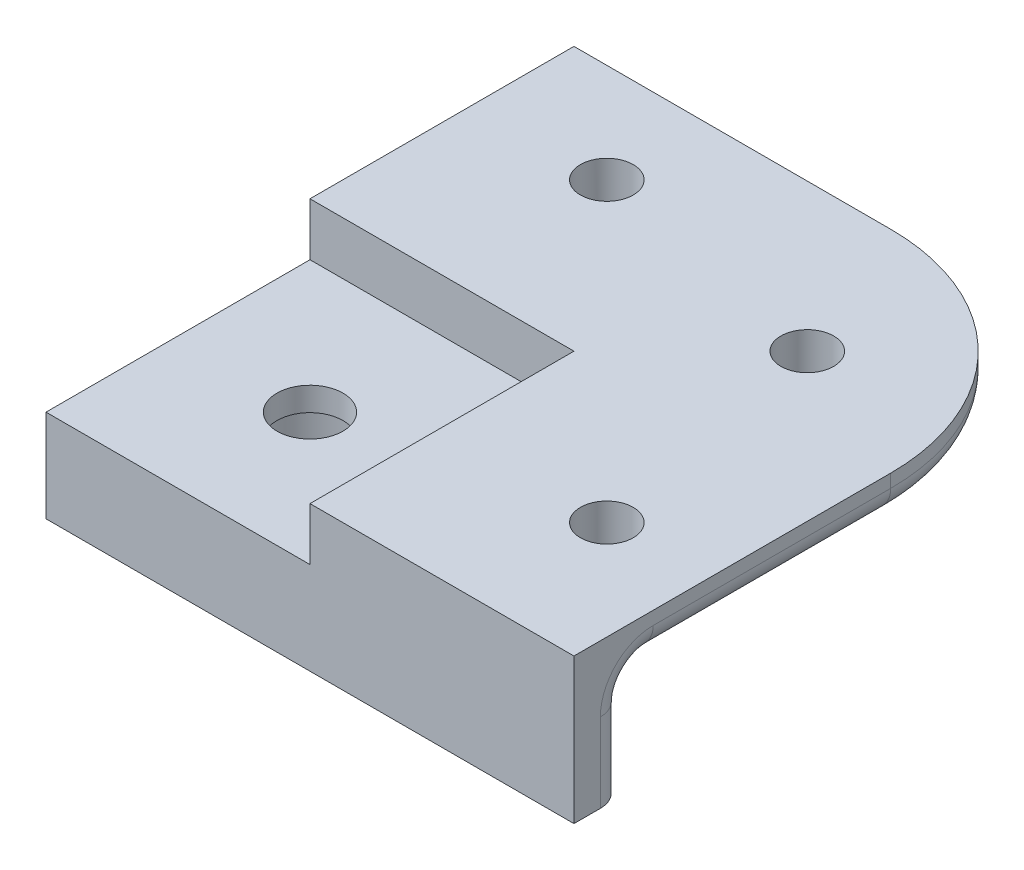
from build123d import *

# Parameters (mm, degrees)
SKETCH1_W           = 4
SKETCH1_H           = 16
BOSS_EXTRUDE1_DEPTH = 11
SKETCH2_W           = 20
SKETCH2_H           = 20
BOSS_EXTRUDE2_DEPTH = 7
SKETCH3_W           = 20
SKETCH3_H           = 16
SKETCH3_W_2         = 16
SKETCH3_H_2         = 20
BOSS_EXTRUDE3_DEPTH = 3
FILLET1_R           = 2
SKETCH4_R           = 2.5
CUT_EXTRUDE1_DEPTH  = 10
SKETCH5_R           = 4.25
CUT_EXTRUDE2_DEPTH  = 5.2
SKETCH6_R           = 2
CUT_EXTRUDE3_DEPTH  = 5.2


with BuildPart() as part:
    # Sketch1 → Boss-Extrude1 (new body)
    with BuildSketch(Plane(origin=(0, 0, 0), x_dir=(1, 0, 0), z_dir=(0, 1, 0))):
        Polygon((-10, 10), (-6, 10), (-6, 14), (-6, 30), (-10, 30), align=None)
        Polygon((-6, 10), (10, 10), (14, 10), (14, 14), (-6, 14), align=None)
        with Locations((12, 2)):
            Rectangle(SKETCH1_W, SKETCH1_H)
        Polygon((10, -6), (10, -10), (30, -10), (30, -6), (14, -6), align=None)
    extrude(amount=BOSS_EXTRUDE1_DEPTH)

    # Sketch2 → Boss-Extrude2 (add)
    with BuildSketch(Plane(origin=(0, 0, 0), x_dir=(1, 0, 0), z_dir=(0, 1, 0))):
        Rectangle(SKETCH2_W, SKETCH2_H)
    extrude(amount=BOSS_EXTRUDE2_DEPTH)

    # Sketch3 → Boss-Extrude3 (add)
    with BuildSketch(Plane(origin=(0, 11, 0), x_dir=(1, 0, 0), z_dir=(0, 1, 0))):
        with Locations((4, 22)):
            Rectangle(SKETCH3_W, SKETCH3_H)
        with BuildLine():
            Line((30, 14), (14, 14))
            Line((14, 14), (14, 30))
            ThreePointArc((14, 30), (25.313708499, 25.313708499), (30, 14))
        make_face()
        with Locations((22, 4)):
            Rectangle(SKETCH3_W_2, SKETCH3_H_2)
    extrude(amount=-BOSS_EXTRUDE3_DEPTH)

    # Fillet1
    fillet1_edges = [part.edges().sort_by_distance(p)[0] for p in [
        (-6, 4, -30),
        (-6, 4, -14),
        (14, 4, -14),
        (14, 4, 6),
        (30, 4, 6),
        (25.313708499, 8, -25.313708499),
        (30, 8, -4),
        (4, 8, -14),
        (-6, 8, -22),
        (4, 8, -30),
        (22, 8, 6),
        (14, 8, -4),
    ]]
    fillet(fillet1_edges, radius=FILLET1_R)

    # Sketch4 → Cut-Extrude1 (cut)
    with BuildSketch(Plane.XZ):
        with Locations(Location((0, 0, 0), (0, 0, 270))):
            Circle(SKETCH4_R)
    extrude(amount=-CUT_EXTRUDE1_DEPTH, mode=Mode.SUBTRACT)

    # Sketch5 → Cut-Extrude2 (cut)
    with BuildSketch(Plane.XZ):
        with Locations(Location((0, 0, 0), (0, 0, 270))):
            Circle(SKETCH5_R)
    extrude(amount=-CUT_EXTRUDE2_DEPTH, mode=Mode.SUBTRACT)

    # Sketch6 → Cut-Extrude3 (cut)
    with BuildSketch(Plane(origin=(0, 11, 0), x_dir=(1, 0, 0), z_dir=(0, 1, 0))):
        with Locations(Location((22.489995997, 0, 0), (0, 0, 270))):
            Circle(SKETCH6_R)
        with Locations(Location((0, 22.489995997, 0), (0, 0, 270))):
            Circle(SKETCH6_R)
        with Locations(Location((18.838834765, 18.838834765, 0), (0, 0, 270))):
            Circle(SKETCH6_R)
    extrude(amount=-CUT_EXTRUDE3_DEPTH, mode=Mode.SUBTRACT)


solid = part.part
